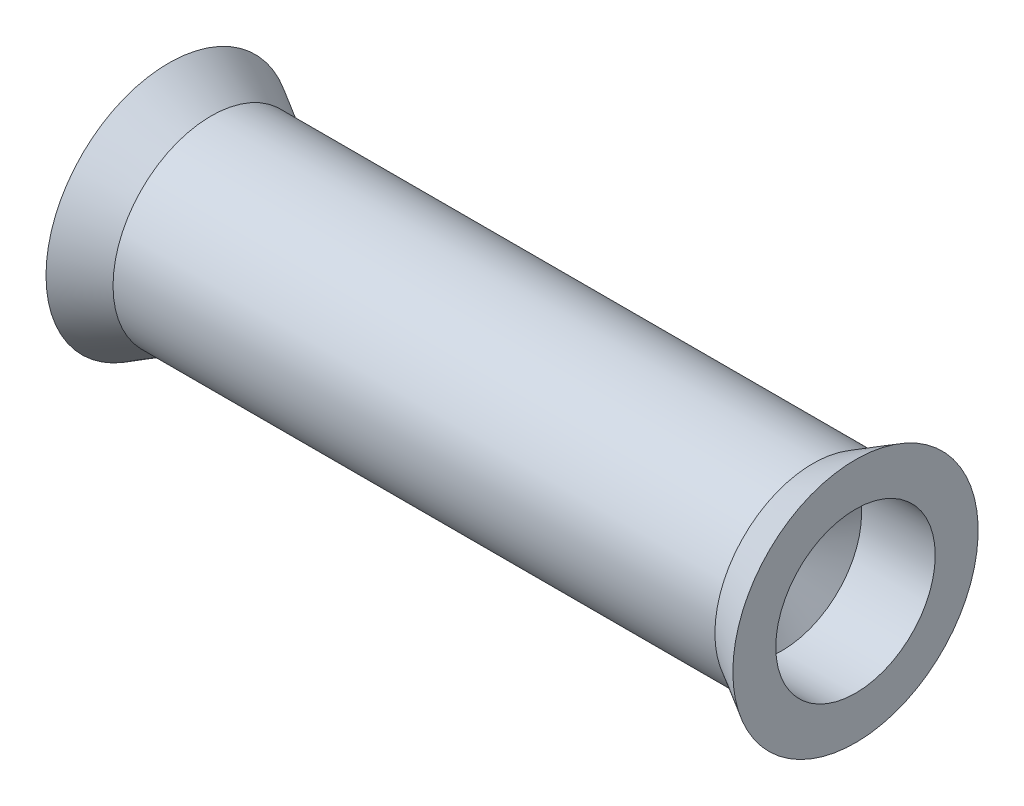
from build123d import *

# Parameters (mm, degrees)
SKETCH1_W = 30
SKETCH1_H = 4
SKETCH2_W = 2
SKETCH2_H = 5


with BuildPart() as part:
    # Sketch1 → Base-Revolve (revolve)
    with BuildSketch(Plane.XY, mode=Mode.PRIVATE) as base_revolve_sk:
        with Locations((0, 2)):
            Rectangle(SKETCH1_W, SKETCH1_H)
    revolve(base_revolve_sk.sketch.rotate(Axis((-30, 0, 0), (1, 0, 0)), 90), axis=Axis((-30, 0, 0), (1, 0, 0)))

    # Sketch2 → Cut-to-GripLength (revolve, cut)
    with BuildSketch(Plane.XY):
        with Locations((-15, 2.5)):
            Rectangle(SKETCH2_W, SKETCH2_H)
        with Locations((15, 2.5)):
            Rectangle(SKETCH2_W, SKETCH2_H)
    revolve(axis=Axis((-30, 0, 0), (1, 0, 0)), mode=Mode.SUBTRACT)

    # Sketch4 → HeadTypeB (revolve)
    with BuildSketch(Plane.XY, mode=Mode.PRIVATE) as headtypeb_sk:
        Polygon((-14, 0), (-14, 5), (-12.267949192, 4), (-12.267949192, 0), align=None)
        Polygon((12.267949192, 0), (14, 0), (14, 5), (12.267949192, 4), align=None)
    revolve(headtypeb_sk.sketch.rotate(Axis((-20, 0, 0), (1, 0, 0)), 90), axis=Axis((-20, 0, 0), (1, 0, 0)))

    # Sketch5 → HoleTypeA (revolve, cut)
    with BuildSketch(Plane.XY, mode=Mode.PRIVATE) as holetypea_sk:
        Polygon((-9.123611625, 0), (-11, 3.25), (-15, 3.25), (-15, 0), align=None)
        Polygon((9.123611625, 0), (11, 3.25), (15, 3.25), (15, 0), align=None)
    revolve(holetypea_sk.sketch.rotate(Axis((-22, 0, 0), (1, 0, 0)), 90), axis=Axis((-22, 0, 0), (1, 0, 0)), mode=Mode.SUBTRACT)


solid = part.part
